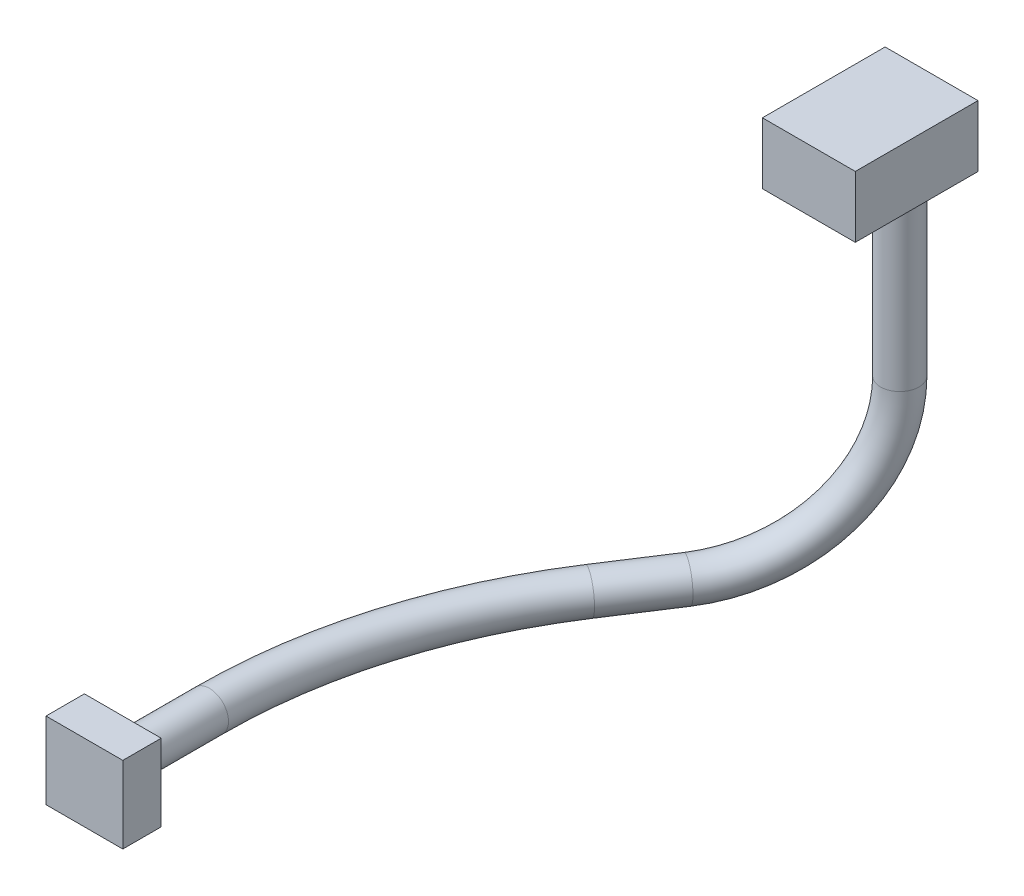
from build123d import *

# Parameters (mm, degrees)
SWEEP_1_PROFILE_R = 2.5
SKETCH_10_W       = 10
SKETCH_10_H       = 10
EXTRUDE_1_DEPTH   = 5
SKETCH_11_W       = 12.093454082
SKETCH_11_H       = 15.976124646
EXTRUDE_2_DEPTH   = 8


with BuildPart() as part:
    # 扫描1: sweep along a curve in space
    with BuildLine() as sweep_1_path:
        Line((0, 0, 0), (0, 0, -11.265055353))
        ThreePointArc((11.293060244, 0, -49.389787804), (2.882618559, 0, -31.146129482), (0, 0, -11.265055353))
        Line((11.293060244, 0, -49.389787804), (16.33917105, 0, -57.160117038))
        ThreePointArc((27.231951751, 20, -73.933528397), (24.04153015, 5.857864376, -69.020709954), (16.33917105, 0, -57.160117038))
        Line((27.231951751, 20, -73.933528397), (27.231951751, 44, -73.933528397))
    # 扫描1 profile (on start of the path) → 扫描1 (sweep)
    with BuildSketch(Plane(origin=(0, 0, 0), x_dir=(-1, 0, 0), z_dir=(0, 0, -1))):
        Circle(SWEEP_1_PROFILE_R)
    sweep(path=sweep_1_path.line)

    # 草图10 → 凸台-拉伸1 (add)
    with BuildSketch(Plane.XY):
        Rectangle(SKETCH_10_W, SKETCH_10_H)
    extrude(amount=EXTRUDE_1_DEPTH)

    # 草图11 → 凸台-拉伸2 (add)
    with BuildSketch(Plane(origin=(0, 44, 0), x_dir=(1, 0, 0), z_dir=(0, 1, 0))):
        with Locations((27.231951751, 70.082405306)):
            Rectangle(SKETCH_11_W, SKETCH_11_H)
    extrude(amount=EXTRUDE_2_DEPTH)


solid = part.part
